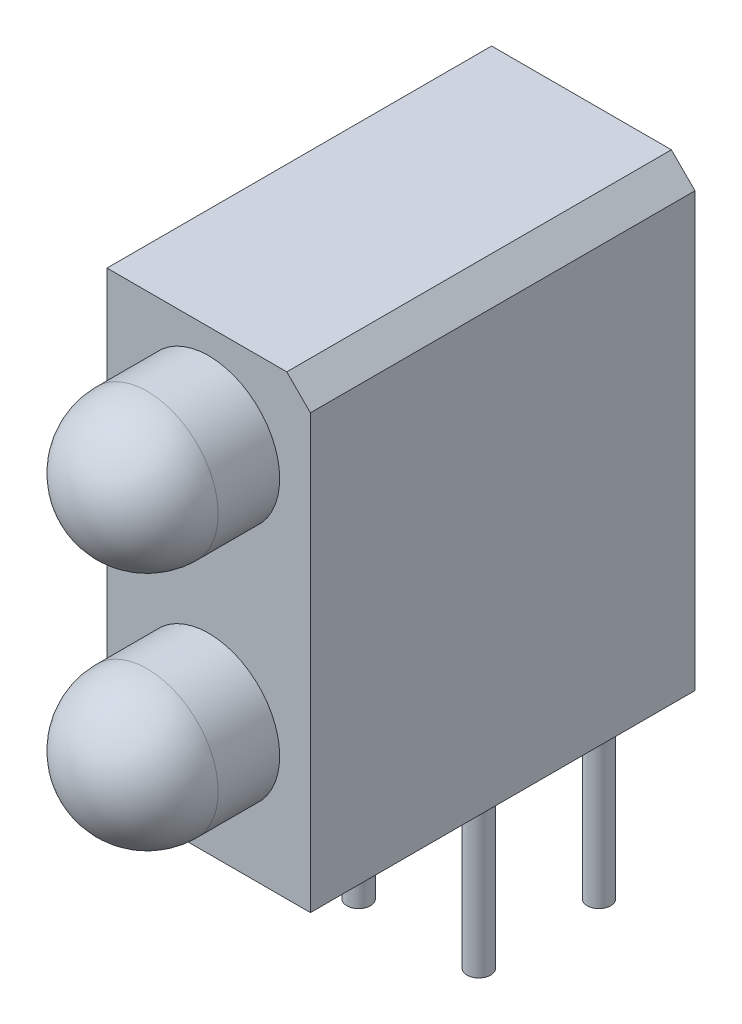
from build123d import *

# Parameters (mm, degrees)
ESQUISSE1_W          = 4.3
ESQUISSE1_H          = 9.65
BOSS_EXTRU_1_DEPTH   = 8.13
ESQUISSE2_R          = 1.5
BOSS_EXTRU_2_DEPTH   = 2.8
BOSS_EXTRU_2_2_DEPTH = 2.8
CONG_1_R             = 1.5
CONG_2_R             = 1.5
CHANFREIN1_SIZE      = 0.5
ESQUISSE3_R          = 0.25
BOSS_EXTRU_3_DEPTH   = 3.68


with BuildPart() as part:
    # Esquisse1 → Boss.-Extru.1 (new body)
    with BuildSketch(Plane.XY):
        with Locations((0, 4.825)):
            Rectangle(ESQUISSE1_W, ESQUISSE1_H)
    extrude(amount=BOSS_EXTRU_1_DEPTH)

    # Chanfrein1
    chanfrein1_edges = [part.edges().sort_by_distance(p)[0] for p in [
        (2.15, 9.65, 4.065),
    ]]
    chamfer(chanfrein1_edges, length=CHANFREIN1_SIZE)

    # Esquisse3 → Boss.-Extru.3 (add)
    with BuildSketch(Plane.XZ):
        with Locations(Location((-1.27, 3.69, 0), (0, 0, 90))):
            Circle(ESQUISSE3_R)
        with Locations(Location((1.27, 3.69, 0), (0, 0, 90))):
            Circle(ESQUISSE3_R)
        with Locations(Location((-1.27, 1.15, 0), (0, 0, 90))):
            Circle(ESQUISSE3_R)
        with Locations(Location((1.27, 1.15, 0), (0, 0, 90))):
            Circle(ESQUISSE3_R)
    extrude(amount=BOSS_EXTRU_3_DEPTH)


with BuildPart() as body_2:
    # Esquisse2 → Boss.-Extru.2 (new body)
    with BuildSketch(Plane.XY.offset(8.13)):
        with Locations((0, 7.62)):
            Circle(ESQUISSE2_R)
    extrude(amount=BOSS_EXTRU_2_DEPTH)

    # Congé1
    cong_1_edges = [body_2.edges().sort_by_distance(p)[0] for p in [
        (-1.5, 7.62, 10.93),
    ]]
    fillet(cong_1_edges, radius=CONG_1_R)


with BuildPart() as body_3:
    # Esquisse2 → Boss.-Extru.2 2 (new body)
    with BuildSketch(Plane.XY.offset(8.13)):
        with Locations((0, 2.54)):
            Circle(ESQUISSE2_R)
    extrude(amount=BOSS_EXTRU_2_2_DEPTH)

    # Congé2
    cong_2_edges = [body_3.edges().sort_by_distance(p)[0] for p in [
        (-1.5, 2.54, 10.93),
    ]]
    fillet(cong_2_edges, radius=CONG_2_R)


solid = Compound([part.part, body_2.part, body_3.part])
